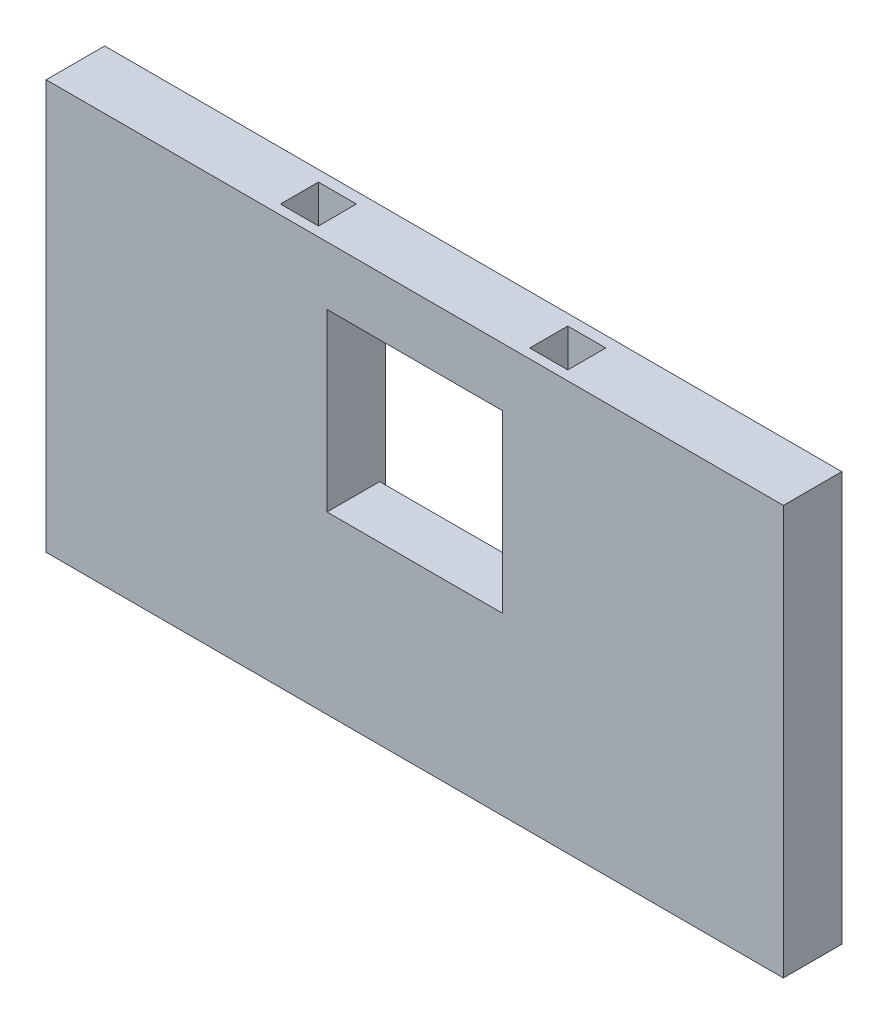
from build123d import *

# Parameters (mm, degrees)
BOSS_EXTRUDE1_DEPTH = 20
SKETCH5_R           = 5.25
CUT_EXTRUDE4_DEPTH  = 20
SKETCH6_W           = 13
SKETCH6_H           = 13
CUT_EXTRUDE5_DEPTH  = 15.5
SKETCH7_W           = 13
SKETCH7_H           = 13
CUT_EXTRUDE6_DEPTH  = 15.5
SKETCH8_W           = 300
SKETCH8_H           = 102
BOSS_EXTRUDE2_DEPTH = 20
CUT_EXTRUDE7_START  = -150
SKETCH9_W           = 47.842391085
SKETCH9_H           = 20
CUT_EXTRUDE7_DEPTH  = 150
CUT_EXTRUDE9_DEPTH  = 40
CUT_EXTRUDE10_DEPTH = 60
SKETCH17_W          = 60
SKETCH17_H          = 5
CUT_EXTRUDE12_DEPTH = 38
CUT_EXTRUDE13_DEPTH = 60
SKETCH10_W          = 252.157608915
SKETCH10_H          = 50
CUT_EXTRUDE8_DEPTH  = 310
BOSS_EXTRUDE3_DEPTH = 50
SKETCH21_W          = 252.157608915
SKETCH21_H          = 10
CUT_EXTRUDE14_DEPTH = 54
SKETCH23_W          = 60
SKETCH23_H          = 5
BOSS_EXTRUDE5_DEPTH = 20
CUT_EXTRUDE15_DEPTH = 20
SKETCH22_W          = 60
SKETCH22_H          = 5
BOSS_EXTRUDE4_DEPTH = 20


with BuildPart() as part:
    # Sketch1 → Boss-Extrude1 (new body)
    with BuildSketch(Plane.XY):
        Polygon((-107.821386225, 92.09039548), (-7.821386225, 92.09039548), (117.178613775, 92.09039548), (117.178613775, 44.09039548), (-7.821386225, 44.09039548), (-107.821386225, 44.09039548), (-182.821386225, 44.09039548), (-182.821386225, 92.09039548), align=None)
    extrude(amount=BOSS_EXTRUDE1_DEPTH)

    # Sketch5 → Cut-Extrude4 (cut)
    with BuildSketch(Plane(origin=(0, 92.09039548, 0), x_dir=(1, 0, 0), z_dir=(0, 1, 0))):
        with Locations(Location((-66.321386225, -10, 0), (0, 0, 180))):
            Circle(SKETCH5_R)
        with Locations(Location((-47.321386225, -10, 0), (0, 0, 180))):
            Circle(SKETCH5_R)
    extrude(amount=-CUT_EXTRUDE4_DEPTH, mode=Mode.SUBTRACT)

    # Sketch6 → Cut-Extrude5 (cut)
    with BuildSketch(Plane(origin=(0, 92.09039548, 0), x_dir=(1, 0, 0), z_dir=(0, 1, 0))):
        with Locations((-99.441386225, -10.25)):
            Rectangle(SKETCH6_W, SKETCH6_H)
    extrude(amount=-CUT_EXTRUDE5_DEPTH, mode=Mode.SUBTRACT)

    # Sketch7 → Cut-Extrude6 (cut)
    with BuildSketch(Plane(origin=(0, 92.09039548, 0), x_dir=(1, 0, 0), z_dir=(0, 1, 0))):
        with Locations((-14.16377731, -10.25)):
            Rectangle(SKETCH7_W, SKETCH7_H)
    extrude(amount=-CUT_EXTRUDE6_DEPTH, mode=Mode.SUBTRACT)

    # Sketch8 → Boss-Extrude2 (add)
    with BuildSketch(Plane.XY.offset(20)):
        with Locations((-32.821386225, -6.90960452)):
            Rectangle(SKETCH8_W, SKETCH8_H)
    extrude(amount=-BOSS_EXTRUDE2_DEPTH)

    # Sketch9 → Cut-Extrude7 (cut)
    with BuildSketch(Plane(origin=(0, 92.09039548, 0), x_dir=(1, 0, 0), z_dir=(0, 1, 0)).offset(CUT_EXTRUDE7_START)):
        with Locations((93.257418233, -10)):
            Rectangle(SKETCH9_W, SKETCH9_H)
    extrude(amount=CUT_EXTRUDE7_DEPTH, mode=Mode.SUBTRACT)

    # Sketch11 → Cut-Extrude9 (cut)
    with BuildSketch(Plane.XY.offset(20)):
        Polygon((-26.742581768, 62.09039548), (-26.742581768, 12.09039548), (-86.742581768, 12.09039548), (-86.742581768, 62.09039548), (-86.742581768, 64.09039548), (-26.742581768, 64.09039548), align=None)
    extrude(amount=-CUT_EXTRUDE9_DEPTH, mode=Mode.SUBTRACT)

    # Sketch14 → Cut-Extrude10 (cut)
    with BuildSketch(Plane(origin=(-86.742581768, 0, 0), x_dir=(0, 0, -1), z_dir=(1, 0, 0))):
        Polygon((0, 64.09039548), (-20, 67.09039548), (-20, 64.09039548), align=None)
    extrude(amount=CUT_EXTRUDE10_DEPTH, mode=Mode.SUBTRACT)

    # Sketch17 → Cut-Extrude12 (cut)
    with BuildSketch(Plane(origin=(0, 0, 0), x_dir=(-1, 0, 0), z_dir=(0, 0, -1))):
        with Locations((56.742581768, 89.59039548)):
            Rectangle(SKETCH17_W, SKETCH17_H)
    extrude(amount=-CUT_EXTRUDE12_DEPTH, mode=Mode.SUBTRACT)

    # Sketch19 → Cut-Extrude13 (cut)
    with BuildSketch(Plane.ZY.offset(26.742581768)):
        Polygon((0, 12.09039548), (2, 12.09039548), (8, -57.90960452), (0, -57.90960452), align=None)
    extrude(amount=CUT_EXTRUDE13_DEPTH, mode=Mode.SUBTRACT)

    # Sketch10 → Cut-Extrude8 (cut)
    with BuildSketch(Plane(origin=(0, 0, 0), x_dir=(-1, 0, 0), z_dir=(0, 0, -1))):
        with Locations((56.742581767, -32.90960452)):
            Rectangle(SKETCH10_W, SKETCH10_H)
    extrude(amount=-CUT_EXTRUDE8_DEPTH, mode=Mode.SUBTRACT)

    # Sketch20 → Boss-Extrude3 (add)
    with BuildSketch(Plane.XZ.offset(7.90960452)):
        Polygon((69.33622269, 20), (-182.821386225, 20), (-182.821386225, 0), (-86.742581768, 0), (-86.742581768, 3.714285714), (-26.742581768, 3.714285714), (-26.742581768, 0), (69.33622269, 0), align=None)
    extrude(amount=BOSS_EXTRUDE3_DEPTH)

    # Sketch21 → Cut-Extrude14 (cut)
    with BuildSketch(Plane.XY.offset(20)):
        with Locations((-56.742581767, -52.90960452)):
            Rectangle(SKETCH21_W, SKETCH21_H)
    extrude(amount=-CUT_EXTRUDE14_DEPTH, mode=Mode.SUBTRACT)

    # Sketch23 → Boss-Extrude5 (add)
    with BuildSketch(Plane.XY.offset(20)):
        with Locations((-56.742581768, 89.59039548)):
            Rectangle(SKETCH23_W, SKETCH23_H)
    extrude(amount=-BOSS_EXTRUDE5_DEPTH)

    # Sketch24 → Cut-Extrude15 (cut)
    with BuildSketch(Plane.XY.offset(20)):
        Polygon((-86.742581768, 67.09039548), (-86.742581768, 72.09039548), (-26.742581768, 72.09039548), (-26.742581768, 67.09039548), (-26.742581768, 61.01073747), (-86.742581768, 61.01073747), align=None)
    extrude(amount=-CUT_EXTRUDE15_DEPTH, mode=Mode.SUBTRACT)

    # Sketch22 → Boss-Extrude4 (add)
    with BuildSketch(Plane.XY.offset(20)):
        with Locations((-56.742581768, 89.59039548)):
            Rectangle(SKETCH22_W, SKETCH22_H)
    extrude(amount=-BOSS_EXTRUDE4_DEPTH)


solid = part.part
